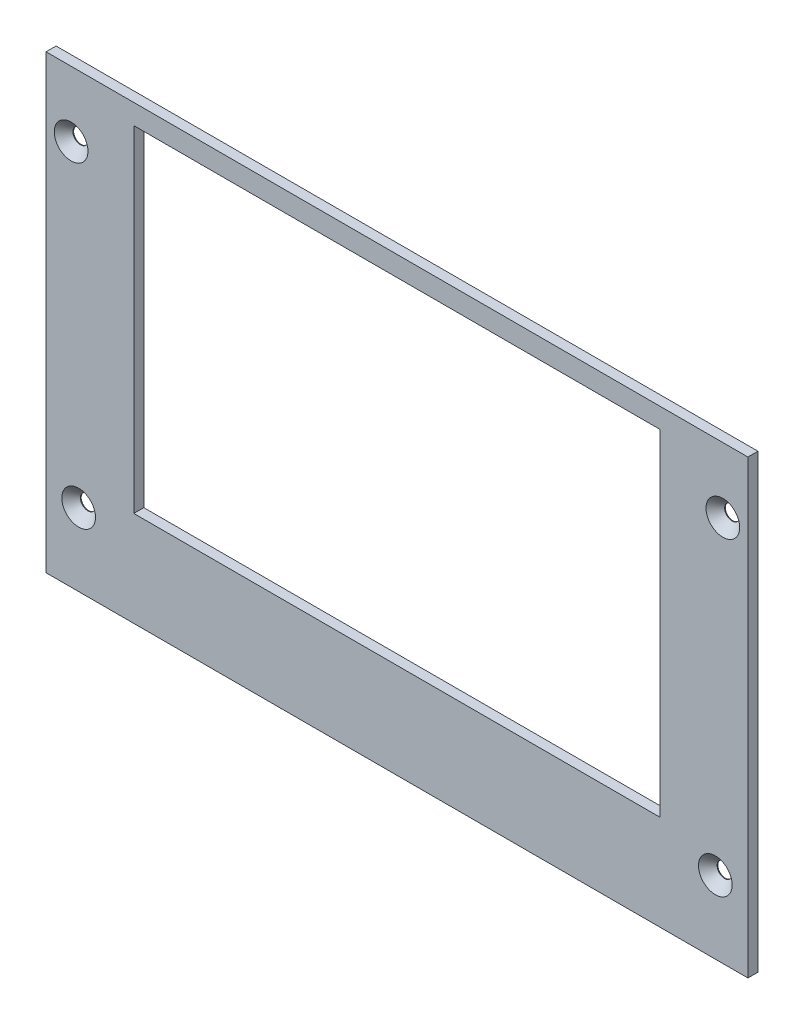
from build123d import *

# Parameters (mm, degrees)
SKETCH1_W           = 140
SKETCH1_H           = 90
SKETCH1_W_2         = 105
SKETCH1_H_2         = 67
BOSS_EXTRUDE1_DEPTH = 2
SKETCH2_R           = 1.5
CUT_EXTRUDE1_DEPTH  = 89.602535605
CHAMFER1_SIZE       = 1.86
SKETCH8_W           = 117.8
SKETCH8_H           = 1
BOSS_EXTRUDE3_DEPTH = 1


with BuildPart() as part:
    # Sketch1 → Boss-Extrude1 (new body)
    with BuildSketch(Plane.XY):
        with Locations((1.473041333, -7.32603251)):
            Rectangle(SKETCH1_W, SKETCH1_H)
        with Locations((1.473041333, 0.17396749)):
            Rectangle(SKETCH1_W_2, SKETCH1_H_2, mode=Mode.SUBTRACT)
    extrude(amount=BOSS_EXTRUDE1_DEPTH)

    # Sketch2 → Cut-Extrude1 (cut, through all)
    with BuildSketch(Plane(origin=(0, 0, 0), x_dir=(-1, 0, 0), z_dir=(0, 0, -1))):
        with Locations((62.026958667, -37.82603251)):
            Circle(SKETCH2_R)
        with Locations((63.526958667, 24.67396749)):
            Circle(SKETCH2_R)
        with Locations((-64.973041333, -37.82603251)):
            Circle(SKETCH2_R)
        with Locations((-66.473041333, 24.67396749)):
            Circle(SKETCH2_R)
    extrude(amount=-CUT_EXTRUDE1_DEPTH, mode=Mode.SUBTRACT)

    # Chamfer1
    chamfer1_edges = [part.edges().sort_by_distance(p)[0] for p in [
        (-60.526958667, -37.82603251, 2),
        (-62.026958667, 24.67396749, 2),
        (66.473041333, -37.82603251, 2),
        (67.973041333, 24.67396749, 2),
    ]]
    chamfer(chamfer1_edges, length=CHAMFER1_SIZE)

    # Sketch8 → Boss-Extrude3 (add)
    with BuildSketch(Plane(origin=(0, 0, 0), x_dir=(-1, 0, 0), z_dir=(0, 0, -1))):
        with Locations((-1.473041333, -49.72603251)):
            Rectangle(SKETCH8_W, SKETCH8_H)
        with Locations((-1.473041333, 35.07396749)):
            Rectangle(SKETCH8_W, SKETCH8_H)
    extrude(amount=BOSS_EXTRUDE3_DEPTH)


solid = part.part
